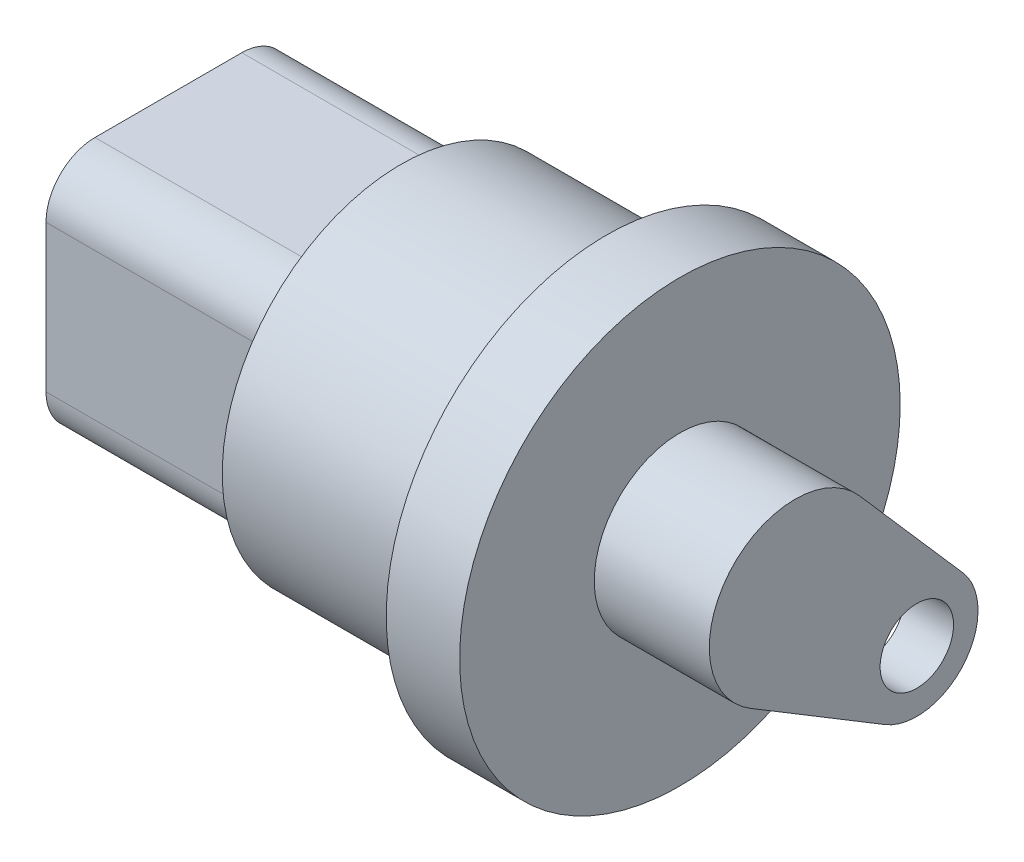
from build123d import *

# Parameters (mm, degrees)
SKETCH2_R           = 9
BOSS_EXTRUDE1_DEPTH = 3
SKETCH2_4_R         = 7.3
BOSS_EXTRUDE2_DEPTH = 8.4
BOSS_EXTRUDE3_START = -8.4
SKETCH2_6_W         = 10
SKETCH2_6_H         = 10
BOSS_EXTRUDE3_DEPTH = 9.5
BOSS_EXTRUDE6_START = 3
SKETCH6_R           = 3.5
BOSS_EXTRUDE6_DEPTH = 2.7
BOSS_EXTRUDE7_START = 5.7
BOSS_EXTRUDE7_DEPTH = 2
CUT_EXTRUDE1_DEPTH  = 3
FILLET1_R           = 2


with BuildPart() as part:
    # Sketch2 → Boss-Extrude1 (new body)
    with BuildSketch(Plane(origin=(0, 0, 0), x_dir=(0, 0, -1), z_dir=(1, 0, 0))):
        Circle(SKETCH2_R)
    extrude(amount=BOSS_EXTRUDE1_DEPTH)

    # Sketch2<4> → Boss-Extrude2 (add)
    with BuildSketch(Plane(origin=(0, 0, 0), x_dir=(0, 0, -1), z_dir=(1, 0, 0))):
        Circle(SKETCH2_4_R)
    extrude(amount=-BOSS_EXTRUDE2_DEPTH)

    # Sketch2<6> → Boss-Extrude3 (add)
    with BuildSketch(Plane(origin=(0, 0, 0), x_dir=(0, 0, -1), z_dir=(1, 0, 0)).offset(BOSS_EXTRUDE3_START)):
        Rectangle(SKETCH2_6_W, SKETCH2_6_H)
    extrude(amount=-BOSS_EXTRUDE3_DEPTH)

    # Sketch6 → Boss-Extrude6 (add)
    with BuildSketch(Plane(origin=(0, 0, 0), x_dir=(0, 0, -1), z_dir=(1, 0, 0)).offset(BOSS_EXTRUDE6_START)):
        with Locations(Location((0, 0, 0), (0, 0, 180))):
            Circle(SKETCH6_R)
    extrude(amount=BOSS_EXTRUDE6_DEPTH)

    # Sketch6<4> → Boss-Extrude7 (add)
    with BuildSketch(Plane(origin=(0, 0, 0), x_dir=(0, 0, -1), z_dir=(1, 0, 0)).offset(BOSS_EXTRUDE7_START)):
        with BuildLine():
            ThreePointArc((6.861759117, -2.533034113), (4.954197643, -1.67824538), (3.064177772, -2.571150439))
            Line((3.064177772, -2.571150439), (3.830222216, -3.213938048))
            ThreePointArc((3.830222216, -3.213938048), (5.492319095, -2.768580532), (6.47928888, -4.178119463))
            ThreePointArc((6.47928888, -4.178119463), (6.388827811, -4.691149678), (6.128355545, -5.142300877))
            Line((6.128355545, -5.142300877), (6.894399988, -5.785088487))
            ThreePointArc((6.894399991, -5.785088484), (7.328520433, -5.033169819), (7.47928888, -4.178119463))
            ThreePointArc((7.47928888, -4.178119463), (7.3198204, -3.29953412), (6.861759117, -2.533034113))
        make_face()
        with BuildLine():
            Line((3.830222216, -3.213938048), (3.064177772, -2.571150439))
            ThreePointArc((3.064177772, -2.571150439), (2.513036454, -4.587507997), (3.6860836, -6.31765682))
            ThreePointArc((3.6860836, -6.31765682), (5.388677416, -6.644371889), (6.894399991, -5.785088484))
            Line((6.894399988, -5.785088487), (6.128355545, -5.142300877))
            ThreePointArc((6.128355545, -5.142300877), (4.015107466, -5.327186128), (3.830222216, -3.213938048))
        make_face()
        with BuildLine():
            ThreePointArc((3.5, 0), (3.288924173, -1.197070502), (2.681155551, -2.249756634))
            Line((2.681155551, -2.249756634), (3.064177772, -2.571150439))
            ThreePointArc((3.064177772, -2.571150439), (4.954197643, -1.67824538), (6.861759117, -2.533034113))
            Line((6.861759117, -2.533034113), (2.635458332, 2.303119489))
            ThreePointArc((2.635458332, 2.303119489), (3.276744128, 1.230019479), (3.5, 0))
        make_face()
        with BuildLine():
            Line((3.064177772, -2.571150439), (2.681155551, -2.249756634))
            ThreePointArc((2.681155551, -2.249756634), (1.479163916, -3.172077255), (0, -3.5))
            Line((0, -3.5), (0, -4.089669185))
            Line((0, -4.089669185), (3.6860836, -6.31765682))
            ThreePointArc((3.6860836, -6.31765682), (2.513036454, -4.587507997), (3.064177772, -2.571150439))
        make_face()
        with BuildLine():
            Line((0, -3.5), (0, 0))
            Line((0, 0), (2.681155551, -2.249756634))
            ThreePointArc((2.681155551, -2.249756634), (3.288924173, -1.197070502), (3.5, 0))
            ThreePointArc((3.5, 0), (3.276744128, 1.230019479), (2.635458332, 2.303119489))
            ThreePointArc((2.635458332, 2.303119489), (-2.681155551, 2.249756634), (-1.810487393, -2.9953523))
            ThreePointArc((-1.810487393, -2.9953523), (-0.939751816, -3.371478389), (0, -3.5))
        make_face()
        with BuildLine():
            Line((2.681155551, -2.249756634), (0, 0))
            Line((0, 0), (0, -3.5))
            ThreePointArc((0, -3.5), (1.479163916, -3.172077255), (2.681155551, -2.249756634))
        make_face()
        with BuildLine():
            Line((0, -4.089669185), (0, -3.5))
            ThreePointArc((0, -3.5), (-0.939751816, -3.371478389), (-1.810487393, -2.9953523))
            Line((-1.810487393, -2.9953523), (0, -4.089669185))
        make_face()
    extrude(amount=BOSS_EXTRUDE7_DEPTH)

    # Sketch6<5> → Cut-Extrude1 (cut)
    with BuildSketch(Plane(origin=(0, 0, 0), x_dir=(0, 0, -1), z_dir=(1, 0, 0))):
        with BuildLine():
            ThreePointArc((6.47928888, -4.178119463), (5.492319095, -2.768580532), (3.830222216, -3.213938048))
            Line((3.830222216, -3.213938048), (6.128355545, -5.142300877))
            ThreePointArc((6.128355545, -5.142300877), (6.388827811, -4.691149678), (6.47928888, -4.178119463))
        make_face()
        with BuildLine():
            Line((6.128355545, -5.142300877), (3.830222216, -3.213938048))
            ThreePointArc((3.830222216, -3.213938048), (4.015107466, -5.327186128), (6.128355545, -5.142300877))
        make_face()
    extrude(amount=CUT_EXTRUDE1_DEPTH, mode=Mode.SUBTRACT)

    # Fillet1
    fillet1_edges = [part.edges().sort_by_distance(p)[0] for p in [
        (-13.15, -5, 5),
        (-13.15, 5, 5),
        (-13.15, 5, -5),
        (-13.15, -5, -5),
    ]]
    fillet(fillet1_edges, radius=FILLET1_R)


solid = part.part
